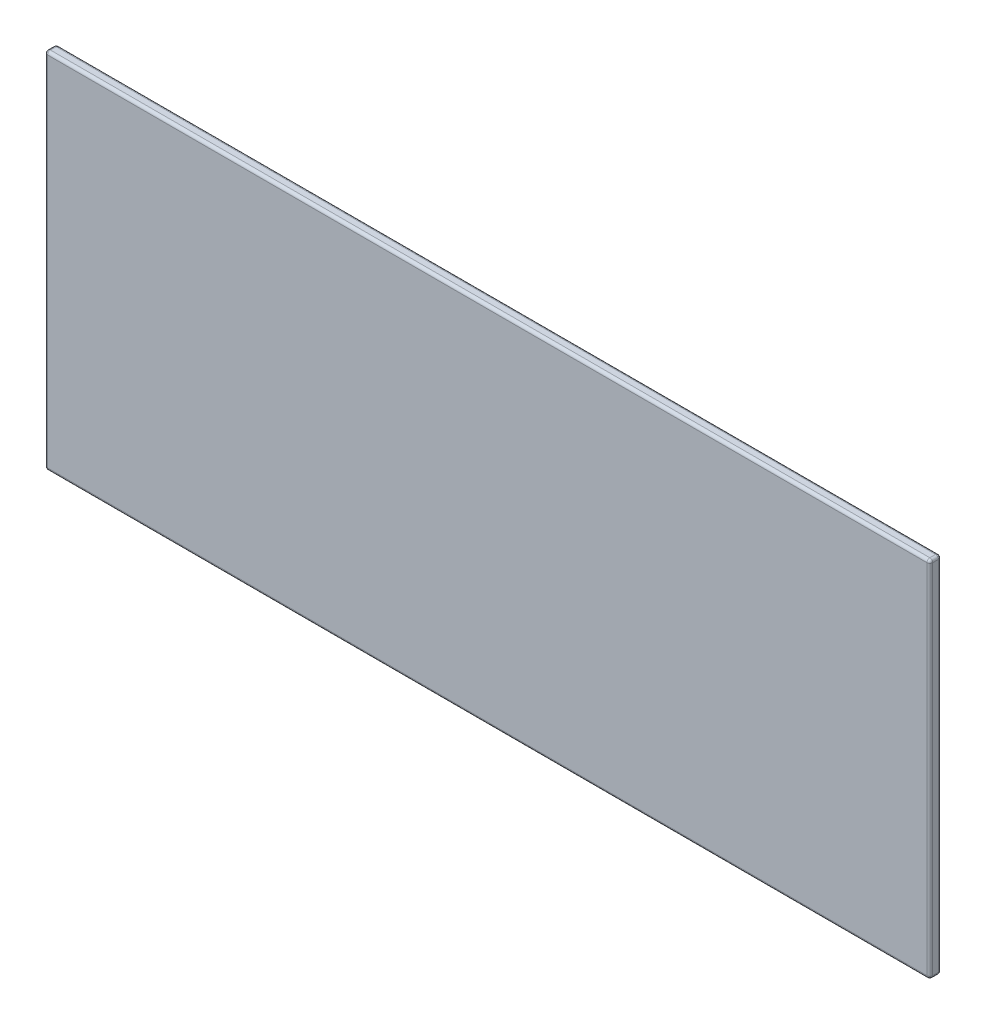
from build123d import *

# Parameters (mm, degrees)
SKETCH1_W           = 154.7
SKETCH1_H           = 63.5
BOSS_EXTRUDE1_DEPTH = 2
FILLET1_R           = 0.5


with BuildPart() as part:
    # Sketch1 → Boss-Extrude1 (new body)
    with BuildSketch(Plane.XY):
        Rectangle(SKETCH1_W, SKETCH1_H)
    extrude(amount=BOSS_EXTRUDE1_DEPTH)

    # Fillet1
    fillet1_edges = [part.edges().sort_by_distance(p)[0] for p in [
        (-77.35, 0, 2),
        (0, -31.75, 2),
        (77.35, 0, 2),
        (0, -31.75, 0),
        (-77.35, 0, 0),
        (0, 31.75, 0),
        (77.35, 0, 0),
        (77.35, -31.75, 1),
        (-77.35, -31.75, 1),
        (-77.35, 31.75, 1),
        (77.35, 31.75, 1),
        (0, 31.75, 2),
    ]]
    fillet(fillet1_edges, radius=FILLET1_R)


solid = part.part
